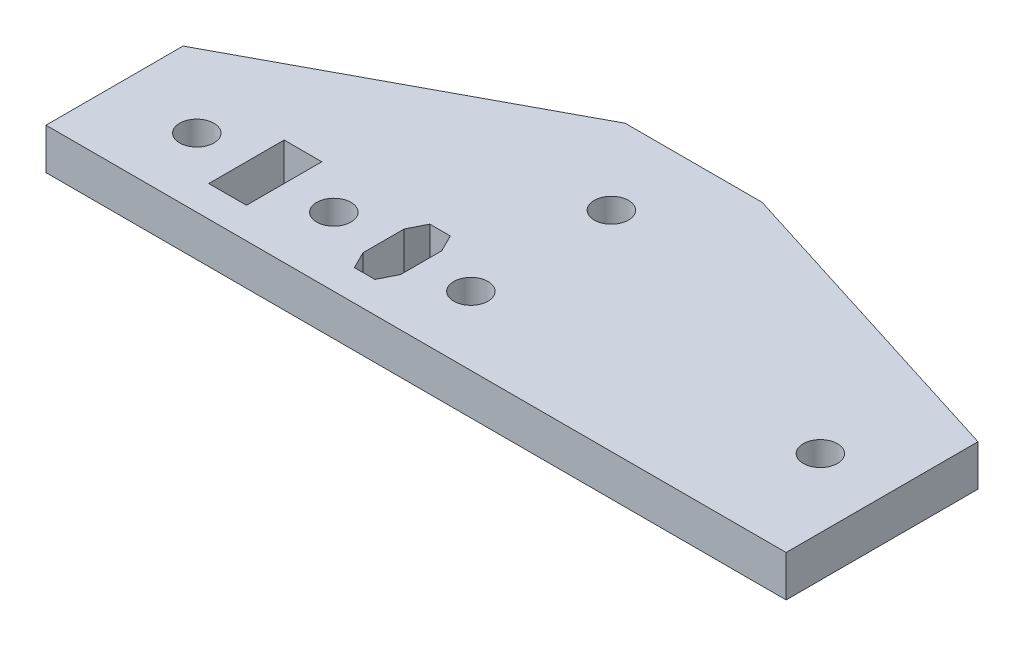
from build123d import *

# Parameters (mm, degrees)
SKETCH1_R           = 2.5
SKETCH1_W           = 5.5
SKETCH1_H           = 11
BOSS_EXTRUDE1_DEPTH = 6


with BuildPart() as part:
    # Sketch1 → Boss-Extrude1 (new body)
    with BuildSketch(Plane(origin=(0, 0, 0), x_dir=(1, 0, 0), z_dir=(0, 1, 0))):
        Polygon((0, 0), (0, 20), (42, 42.5), (62, 42.5), (108, 28), (108, 0), align=None)
        with Locations(Location((52, 30.5, 0), (0, 0, 270))):
            Circle(SKETCH1_R, mode=Mode.SUBTRACT)
        with Locations(Location((52, 10, 0), (0, 0, 270))):
            Circle(SKETCH1_R, mode=Mode.SUBTRACT)
        with Locations(Location((32, 10, 0), (0, 0, 270))):
            Circle(SKETCH1_R, mode=Mode.SUBTRACT)
        with Locations(Location((12, 10, 0), (0, 0, 270))):
            Circle(SKETCH1_R, mode=Mode.SUBTRACT)
        with Locations(Location((98, 15, 0), (0, 0, 270))):
            Circle(SKETCH1_R, mode=Mode.SUBTRACT)
        with Locations((22, 10)):
            Rectangle(SKETCH1_W, SKETCH1_H, mode=Mode.SUBTRACT)
        Polygon((40.5, 15.5), (43.5, 15.5), (44.75, 13), (44.75, 7), (43.5, 4.5), (40.5, 4.5), (39.25, 7), (39.25, 13), align=None, mode=Mode.SUBTRACT)
    extrude(amount=BOSS_EXTRUDE1_DEPTH)


solid = part.part
